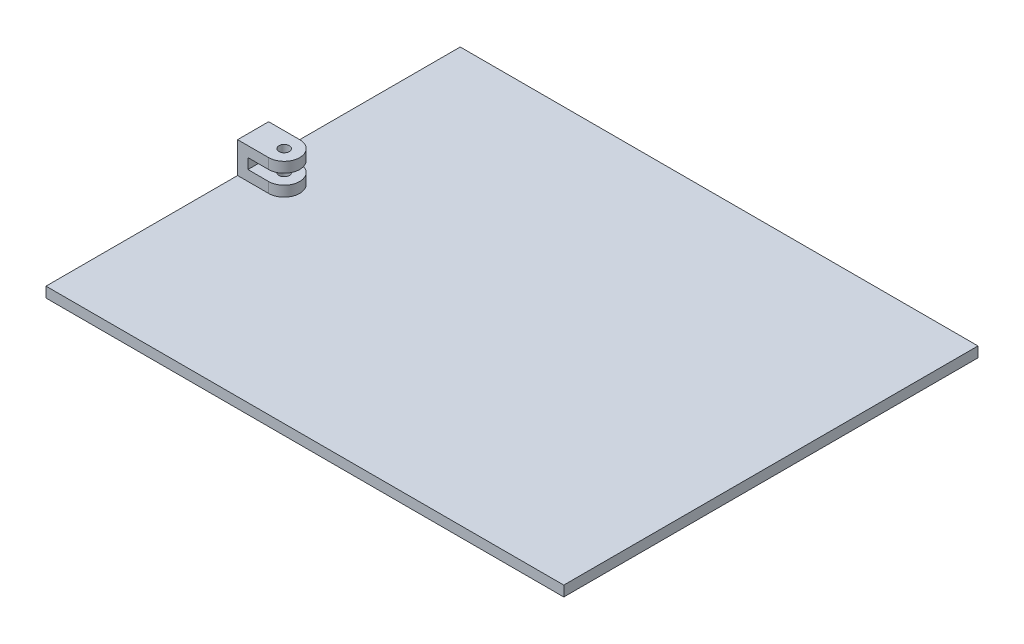
from build123d import *

# Parameters (mm, degrees)
SKETCH1_R           = 5
BOSS_EXTRUDE1_DEPTH = 10
SKETCH2_W           = 30
SKETCH2_H           = 30
BOSS_EXTRUDE2_DEPTH = 10
BOSS_EXTRUDE3_START = -20
SKETCH1_2_R         = 5
BOSS_EXTRUDE3_DEPTH = 10
SKETCH3_W           = 500
SKETCH3_H           = 400
BOSS_EXTRUDE4_DEPTH = 10


with BuildPart() as part:
    # Sketch1 → Boss-Extrude1 (new body)
    with BuildSketch(Plane(origin=(0, 0, 0), x_dir=(1, 0, 0), z_dir=(0, 1, 0))):
        with BuildLine():
            Line((0, 15), (-20, 15))
            Line((-20, 15), (-20, -15))
            Line((-20, -15), (0, -15))
            ThreePointArc((0, -15), (15, 0), (0, 15))
        make_face()
        Circle(SKETCH1_R, mode=Mode.SUBTRACT)
    extrude(amount=-BOSS_EXTRUDE1_DEPTH)

    # Sketch2 → Boss-Extrude2 (add)
    with BuildSketch(Plane.ZY.offset(20)):
        with Locations((0, -15)):
            Rectangle(SKETCH2_W, SKETCH2_H)
    extrude(amount=BOSS_EXTRUDE2_DEPTH)

    # Sketch1<2> → Boss-Extrude3 (add)
    with BuildSketch(Plane(origin=(0, 0, 0), x_dir=(1, 0, 0), z_dir=(0, 1, 0)).offset(BOSS_EXTRUDE3_START)):
        with BuildLine():
            Line((0, 15), (-20, 15))
            Line((-20, 15), (-20, -15))
            Line((-20, -15), (0, -15))
            ThreePointArc((0, -15), (15, 0), (0, 15))
        make_face()
        Circle(SKETCH1_2_R, mode=Mode.SUBTRACT)
    extrude(amount=-BOSS_EXTRUDE3_DEPTH)

    # Sketch3 → Boss-Extrude4 (add)
    with BuildSketch(Plane.XZ.offset(30)):
        with Locations((220, 0)):
            Rectangle(SKETCH3_W, SKETCH3_H)
    extrude(amount=BOSS_EXTRUDE4_DEPTH)


solid = part.part
